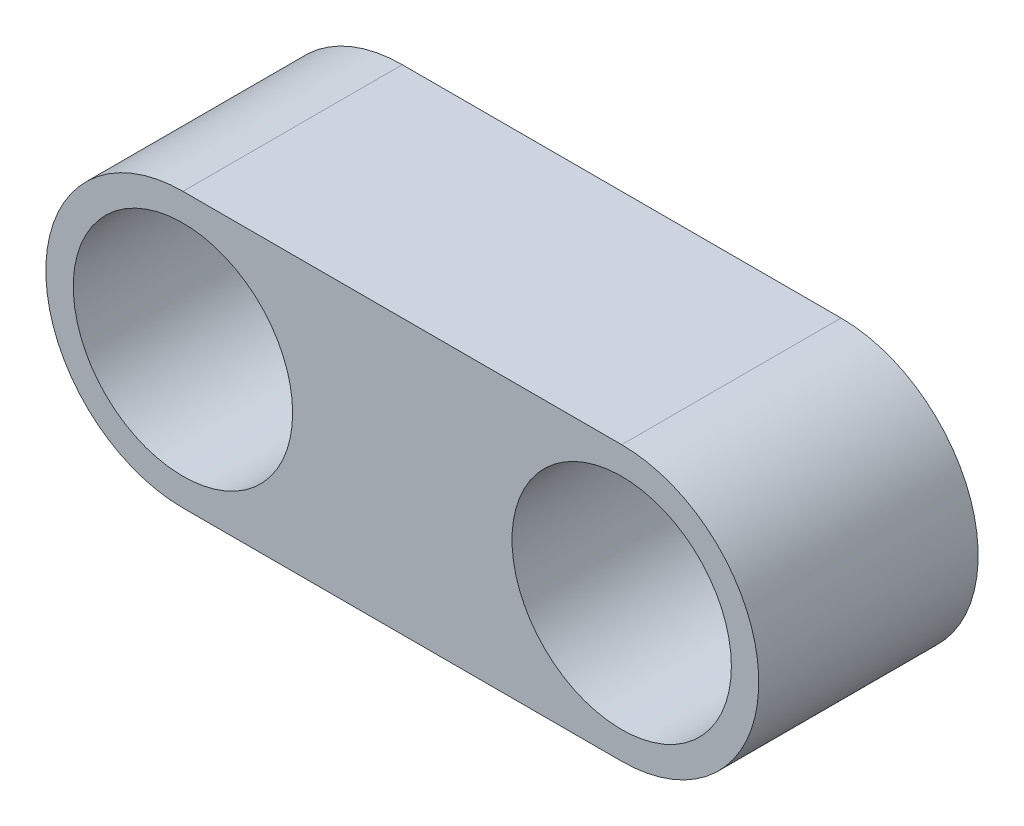
from build123d import *

# Parameters (mm, degrees)
SKETCH1_R           = 25.4
BOSS_EXTRUDE1_DEPTH = 50.8


with BuildPart() as part:
    # Sketch1 → Boss-Extrude1 (new body)
    with BuildSketch(Plane.XY):
        with BuildLine():
            Line((-100.635802195, 31.75), (0.964197805, 31.75))
            ThreePointArc((0.964197805, 31.75), (32.714197805, 0), (0.964197805, -31.75))
            Line((0.964197805, -31.75), (-100.635802195, -31.75))
            ThreePointArc((-100.635802195, -31.75), (-132.385802195, 0), (-100.635802195, 31.75))
        make_face()
        with Locations((-100.635802195, 0)):
            Circle(SKETCH1_R, mode=Mode.SUBTRACT)
        with Locations((0.964197805, 0)):
            Circle(SKETCH1_R, mode=Mode.SUBTRACT)
    extrude(amount=BOSS_EXTRUDE1_DEPTH)


solid = part.part
